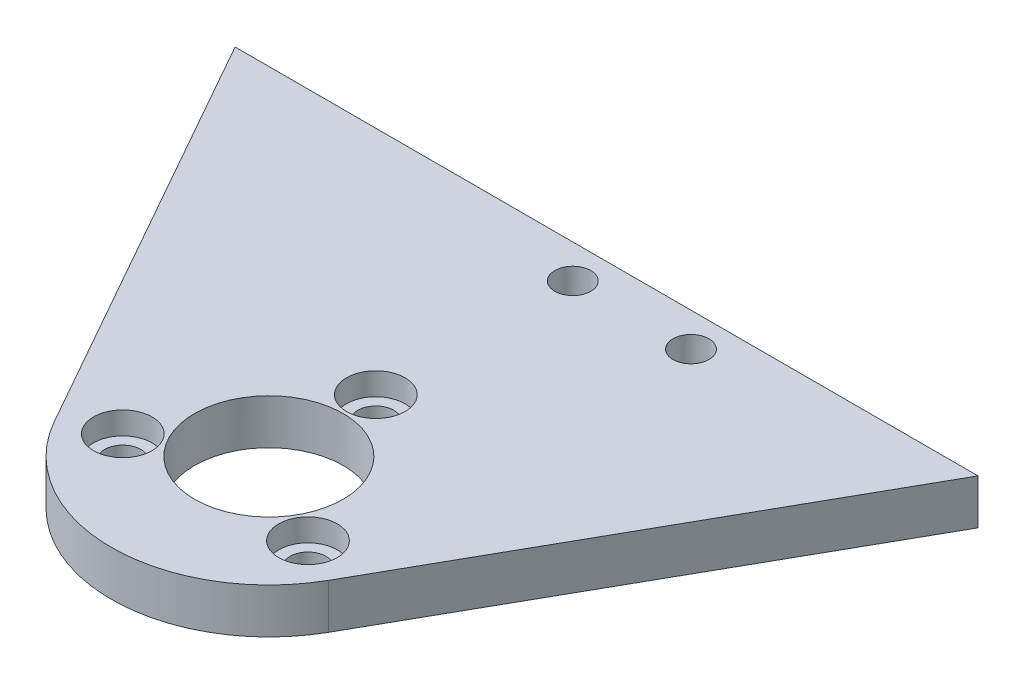
from build123d import *

# Parameters (mm, degrees)
EXTRUDE_1_DEPTH     = 4
SKETCH_3_R          = 1.6
SKETCH_3_R_2        = 6.6
CUT_EXTRUDE_3_DEPTH = 4
SKETCH_4_R          = 1.6
CUT_EXTRUDE_4_DEPTH = 4
SKETCH_5_R          = 2.6
CUT_EXTRUDE_6_DEPTH = 2


with BuildPart() as part:
    # 草图1 → 凸台-拉伸1 (new body)
    with BuildSketch(Plane(origin=(0, 0, 0), x_dir=(1, 0, 0), z_dir=(0, 1, 0))):
        with BuildLine():
            Line((33, 30), (12.193267422, -6.879260831))
            ThreePointArc((12.193267422, -6.879260831), (0, -14), (-12.193267422, -6.879260831))
            Line((-12.193267422, -6.879260831), (-33, 30))
            Line((-33, 30), (33, 30))
        make_face()
    extrude(amount=EXTRUDE_1_DEPTH)

    # 草图3 → 切除-拉伸3 (cut)
    with BuildSketch(Plane(origin=(0, 4, 0), x_dir=(1, 0, 0), z_dir=(0, 1, 0))):
        with Locations(Location((-8.227241336, -4.75, 0), (0, 0, 270))):
            Circle(SKETCH_3_R)
        with Locations(Location((8.227241336, -4.75, 0), (0, 0, 270))):
            Circle(SKETCH_3_R)
        with Locations(Location((0, 0, 0), (0, 0, 270))):
            Circle(SKETCH_3_R_2)
        with Locations(Location((0, 9.5, 0), (0, 0, 270))):
            Circle(SKETCH_3_R)
    extrude(amount=-CUT_EXTRUDE_3_DEPTH, mode=Mode.SUBTRACT)

    # 草图4 → 切除-拉伸4 (cut)
    with BuildSketch(Plane(origin=(0, 4, 0), x_dir=(1, 0, 0), z_dir=(0, 1, 0))):
        with Locations(Location((0, 27, 0), (0, 0, 270))):
            Circle(SKETCH_4_R)
        with Locations(Location((10.5, 27, 0), (0, 0, 270))):
            Circle(SKETCH_4_R)
    extrude(amount=-CUT_EXTRUDE_4_DEPTH, mode=Mode.SUBTRACT)

    # 草图5 → 切除-拉伸6 (cut)
    with BuildSketch(Plane(origin=(0, 4, 0), x_dir=(1, 0, 0), z_dir=(0, 1, 0))):
        with Locations(Location((0, 9.5, 0), (0, 0, 270))):
            Circle(SKETCH_5_R)
        with Locations(Location((8.227241336, -4.75, 0), (0, 0, 270))):
            Circle(SKETCH_5_R)
        with Locations(Location((-8.227241336, -4.75, 0), (0, 0, 270))):
            Circle(SKETCH_5_R)
    extrude(amount=-CUT_EXTRUDE_6_DEPTH, mode=Mode.SUBTRACT)


solid = part.part
